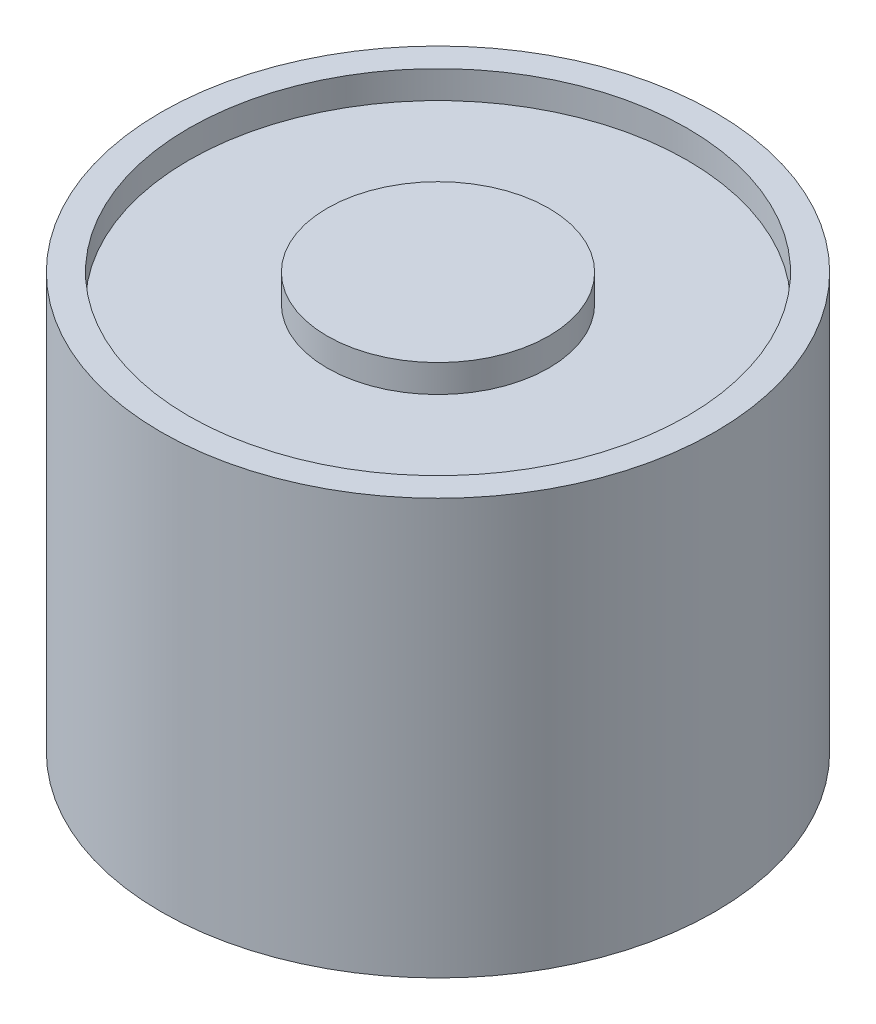
from build123d import *

# Parameters (mm, degrees)
SKETCH1_R           = 10
BOSS_EXTRUDE1_DEPTH = 15
SKETCH2_R           = 9
SKETCH2_R_2         = 4
CUT_EXTRUDE1_DEPTH  = 1
SKETCH3_R           = 1.7
CUT_EXTRUDE2_DEPTH  = 4


with BuildPart() as part:
    # Sketch1 → Boss-Extrude1 (new body)
    with BuildSketch(Plane(origin=(0, 0, 0), x_dir=(1, 0, 0), z_dir=(0, 1, 0))):
        with Locations(Location((0, 0, 0), (0, 0, 270))):
            Circle(SKETCH1_R)
    extrude(amount=BOSS_EXTRUDE1_DEPTH)

    # Sketch2 → Cut-Extrude1 (cut)
    with BuildSketch(Plane(origin=(0, 15, 0), x_dir=(1, 0, 0), z_dir=(0, 1, 0))):
        with Locations(Location((0, 0, 0), (0, 0, 270))):
            Circle(SKETCH2_R)
        with Locations(Location((0, 0, 0), (0, 0, 270))):
            Circle(SKETCH2_R_2, mode=Mode.SUBTRACT)
    extrude(amount=-CUT_EXTRUDE1_DEPTH, mode=Mode.SUBTRACT)

    # Sketch3 → Cut-Extrude2 (cut)
    with BuildSketch(Plane.XZ):
        with Locations(Location((0, 0, 0), (0, 0, 270))):
            Circle(SKETCH3_R)
    extrude(amount=-CUT_EXTRUDE2_DEPTH, mode=Mode.SUBTRACT)


solid = part.part
